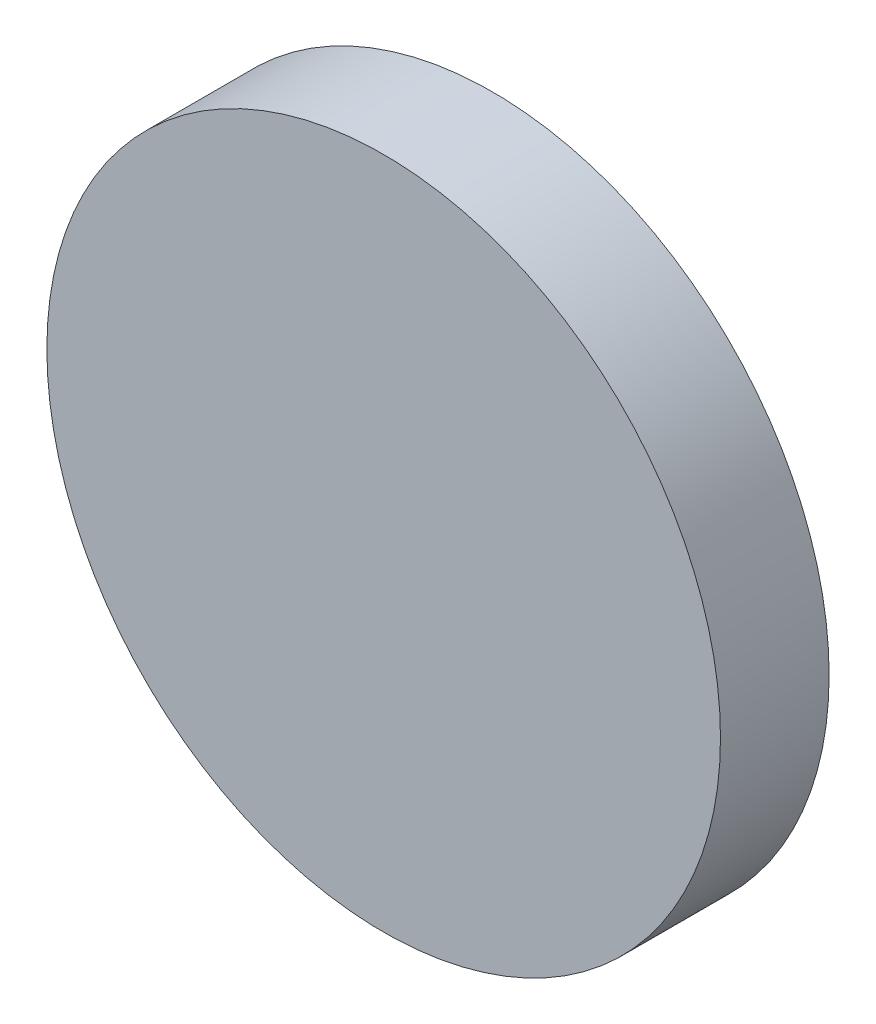
from build123d import *

# Parameters (mm, degrees)
SKETCH1_R           = 15.5
BOSS_EXTRUDE1_DEPTH = 5


with BuildPart() as part:
    # Sketch1 → Boss-Extrude1 (new body)
    with BuildSketch(Plane.XY):
        Circle(SKETCH1_R)
    extrude(amount=-BOSS_EXTRUDE1_DEPTH)


solid = part.part
